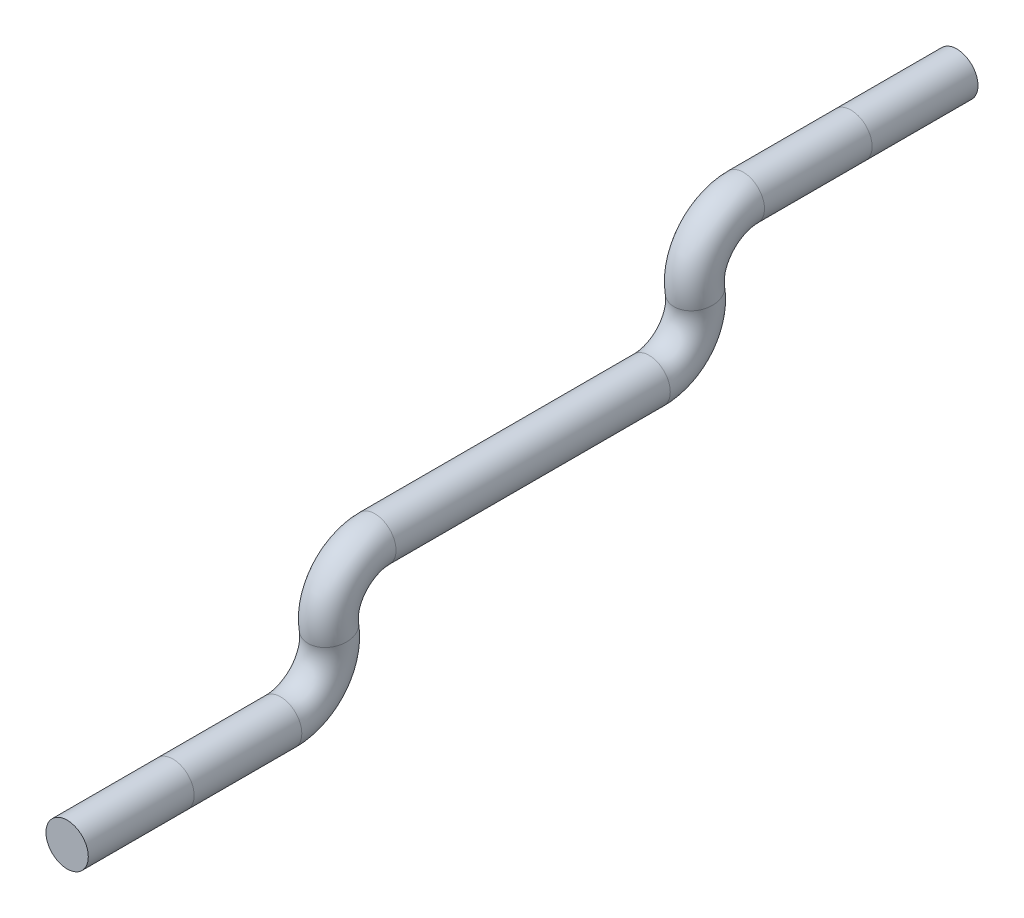
from build123d import *

# Parameters (mm, degrees)
SKETCH3_R = 10


with BuildPart() as part:
    # Sweep2: sweep along a path in Sketch1
    with BuildLine(Plane(origin=(0, 0, 0), x_dir=(0, 0, -1), z_dir=(1, 0, 0))) as sweep2_path:
        Line((-210.124764734, -52.674246303), (-160.124764734, -52.674246303))
        Line((-160.124764734, -52.674246303), (-109.274248541, -52.674246303))
        ThreePointArc((-109.274248541, -52.674246303), (-91.582896902, -44.460377319), (-86.440777952, -25.64521909))
        ThreePointArc((-86.440777952, -25.64521909), (-81.561920639, -7.793342617), (-64.776315105, 0))
        Line((-64.776315105, 0), (64.776315105, 0))
        ThreePointArc((64.776315105, 0), (81.561920639, 7.793342617), (86.440777952, 25.64521909))
        ThreePointArc((86.440777952, 25.64521909), (91.582896902, 44.460377319), (109.274248541, 52.674246303))
        Line((109.274248541, 52.674246303), (160.124764734, 52.674246303))
        Line((160.124764734, 52.674246303), (210.124764734, 52.674246303))
    # Sketch3 → Sweep2 (sweep)
    with BuildSketch(Plane(origin=(0, -52.674246303, 210.124764734), x_dir=(1, 0, 0), z_dir=(0, 0, 1))):
        Circle(SKETCH3_R)
    sweep(path=sweep2_path.line)


solid = part.part
